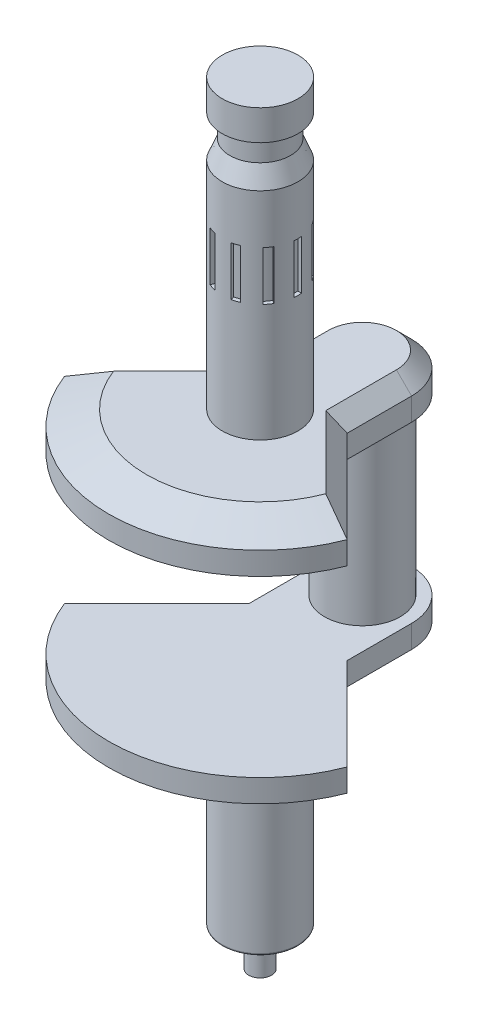
from build123d import *

# Parameters (mm, degrees)
SKETCH1_W                 = 6
SKETCH1_H                 = 8
CUT_EXTRUDE1_REACH        = 80.305
CUT_EXTRUDE1_START_RADIUS = 10
CUT_EXTRUDE1_END_RADIUS   = 10
SKETCH2_W                 = 13
SKETCH2_H                 = 2
CIRPATTERN1_COUNT         = 10
SKETCH3_R                 = 10
BOSS_EXTRUDE1_DEPTH       = 10
CHAMFER2_SIZE             = 4
CHAMFER6_SIZE             = 10
CHAMFER6_SIZE2            = 4
CHAMFER3_SIZE             = 4
CHAMFER5_SIZE             = 4
BODY_MOVE_COPY2_ANGLE     = 180
SKETCH5_R                 = 10
BOSS_EXTRUDE2_DEPTH       = 46
BOSS_EXTRUDE3_START       = 52
SKETCH6_R                 = 10
BOSS_EXTRUDE3_DEPTH       = 52
BOSS_EXTRUDE4_START       = 52
SKETCH6_3_R               = 3
BOSS_EXTRUDE4_DEPTH       = 10
FILLET1_R                 = 0.5


with BuildPart() as part:
    # Sketch1 → Revolve1 (revolve)
    with BuildSketch(Plane.YZ, mode=Mode.PRIVATE) as revolve1_sk:
        Polygon((57, 10), (0, 10), (0, 0), (62, 0), (62, 8), align=None)
        with Locations((65, 4)):
            Rectangle(SKETCH1_W, SKETCH1_H)
        Polygon((68, 10), (68, 8), (68, 0), (76, 0), (76, 10), align=None)
    revolve(revolve1_sk.sketch.rotate(Axis((0, -74.081666102, 0), (0, 1, 0)), 180), axis=Axis((0, -74.081666102, 0), (0, 1, 0)))

    # Cut-Extrude1: from a cylinder face, 80.305 long prism both ways, kept between that surface and its translate by the depth
    cut_extrude1_start = Plane(origin=(0, 37.5, 0), z_dir=(0, -1, 0)) * Cylinder(CUT_EXTRUDE1_START_RADIUS, 181.61, mode=Mode.PRIVATE)
    cut_extrude1_end = Plane(origin=(-1, 37.5, 0), z_dir=(0, -1, 0)) * Cylinder(CUT_EXTRUDE1_END_RADIUS, 181.61, mode=Mode.PRIVATE)
    # Sketch2 → Cut-Extrude1 (cut, from a surface)
    with BuildSketch(Plane.YZ, mode=Mode.PRIVATE) as cut_extrude1_sk1:
        with Locations((37.5, 0)):
            Rectangle(SKETCH2_W, SKETCH2_H)
    cut_extrude1_tool1 = extrude(cut_extrude1_sk1.sketch, amount=CUT_EXTRUDE1_REACH, both=True, mode=Mode.PRIVATE)
    cut_extrude1 = ((cut_extrude1_tool1 & cut_extrude1_start) - cut_extrude1_end).solids().sort_by_distance((9.449874, 37.5, 0))[0]
    add(cut_extrude1, mode=Mode.SUBTRACT)

    # CirPattern1: Cut-Extrude1 ×10 about axis
    cirpattern1_axis = Axis((0, 0, 0), (0, 1, 0))
    for i in range(1, CIRPATTERN1_COUNT):
        add(cut_extrude1.rotate(cirpattern1_axis, i * 360 / CIRPATTERN1_COUNT), mode=Mode.SUBTRACT)


with BuildPart() as body_2:
    # Sketch3 → Boss-Extrude1 (new body)
    # profile 1 of 2: a face of its own
    with BuildSketch(Plane.XZ):
        with BuildLine():
            Line((-37.340859119, 14.340859119), (-13, -10))
            Line((-13, -10), (-13, -27))
            ThreePointArc((-13, -27), (0, -40), (13, -27))
            Line((13, -27), (13, -10))
            Line((13, -10), (37.340859119, 14.340859119))
            ThreePointArc((37.340859119, 14.340859119), (0, 40), (-37.340859119, 14.340859119))
        make_face()
        with Locations(Location((0, 0, 0), (0, 0, 270))):
            Circle(SKETCH3_R, mode=Mode.SUBTRACT)
    # profile 2 of 2: a face of its own
    with BuildSketch(Plane.XZ):
        with Locations(Location((0, 0, 0), (0, 0, 270))):
            Circle(SKETCH3_R)
    extrude(amount=BOSS_EXTRUDE1_DEPTH)

    # Chamfer2
    chamfer2_edges = [body_2.edges().sort_by_distance(p)[0] for p in [
        (-13, 0, -18.5),
        (13, 0, -18.5),
        (0, 0, -40),
    ]]
    chamfer(chamfer2_edges, length=CHAMFER2_SIZE)

    # Chamfer6
    chamfer6_edges = [body_2.edges().sort_by_distance(p)[0] for p in [
        (0, 0, 40),
    ]]
    chamfer6_side = [body_2.faces().sort_by_distance(p)[0] for p in [
        (0, 0, 9.789093574),
    ]]
    chamfer(chamfer6_edges, length=CHAMFER6_SIZE, length2=CHAMFER6_SIZE2, reference=chamfer6_side[0])

    # Chamfer3
    chamfer3_edges = [body_2.edges().sort_by_distance(p)[0] for p in [
        (19.162771735, 0, -3.837228265),
    ]]
    chamfer(chamfer3_edges, length=CHAMFER3_SIZE)

    # Chamfer5
    chamfer5_edges = [body_2.edges().sort_by_distance(p)[0] for p in [
        (-19.162771735, 0, -3.837228265),
    ]]
    chamfer(chamfer5_edges, length=CHAMFER5_SIZE)


with BuildPart() as body_3:
    # Body-Move/Copy1: copy of body 2
    add(body_2.part.moved(Location((0, -36, 0))))


with BuildPart() as body_3_1:
    # Body-Move/Copy2: moved
    add(body_3.part.rotate(Axis((0, -51, 0), (0, 0, 1)), BODY_MOVE_COPY2_ANGLE))


with BuildPart() as body_2_1:
    add(body_2.part)

    add(body_3_1.part)  # Boss-Extrude2 merges body 3
    # Sketch5 → Boss-Extrude2 (add)
    with BuildSketch(Plane.XZ.offset(10)):
        with Locations(Location((0, -27, 0), (0, 0, 270))):
            Circle(SKETCH5_R)
    extrude(amount=BOSS_EXTRUDE2_DEPTH)

    # Sketch6 → Boss-Extrude3 (add)
    with BuildSketch(Plane.XZ.offset(66).offset(BOSS_EXTRUDE3_START)):
        with Locations(Location((0, 0, 0), (0, 0, 180))):
            Circle(SKETCH6_R)
    extrude(amount=-BOSS_EXTRUDE3_DEPTH)

    # Sketch6<3> → Boss-Extrude4 (add)
    with BuildSketch(Plane.XZ.offset(66).offset(BOSS_EXTRUDE4_START)):
        Circle(SKETCH6_3_R)
    extrude(amount=BOSS_EXTRUDE4_DEPTH)

    # Fillet1
    fillet1_edges = [body_2_1.edges().sort_by_distance(p)[0] for p in [
        (10, -118, 0),
    ]]
    fillet(fillet1_edges, radius=FILLET1_R)


with BuildPart() as part_1:
    add(part.part)

    # Combine1: union body 2
    add(body_2_1.part)


solid = part_1.part
